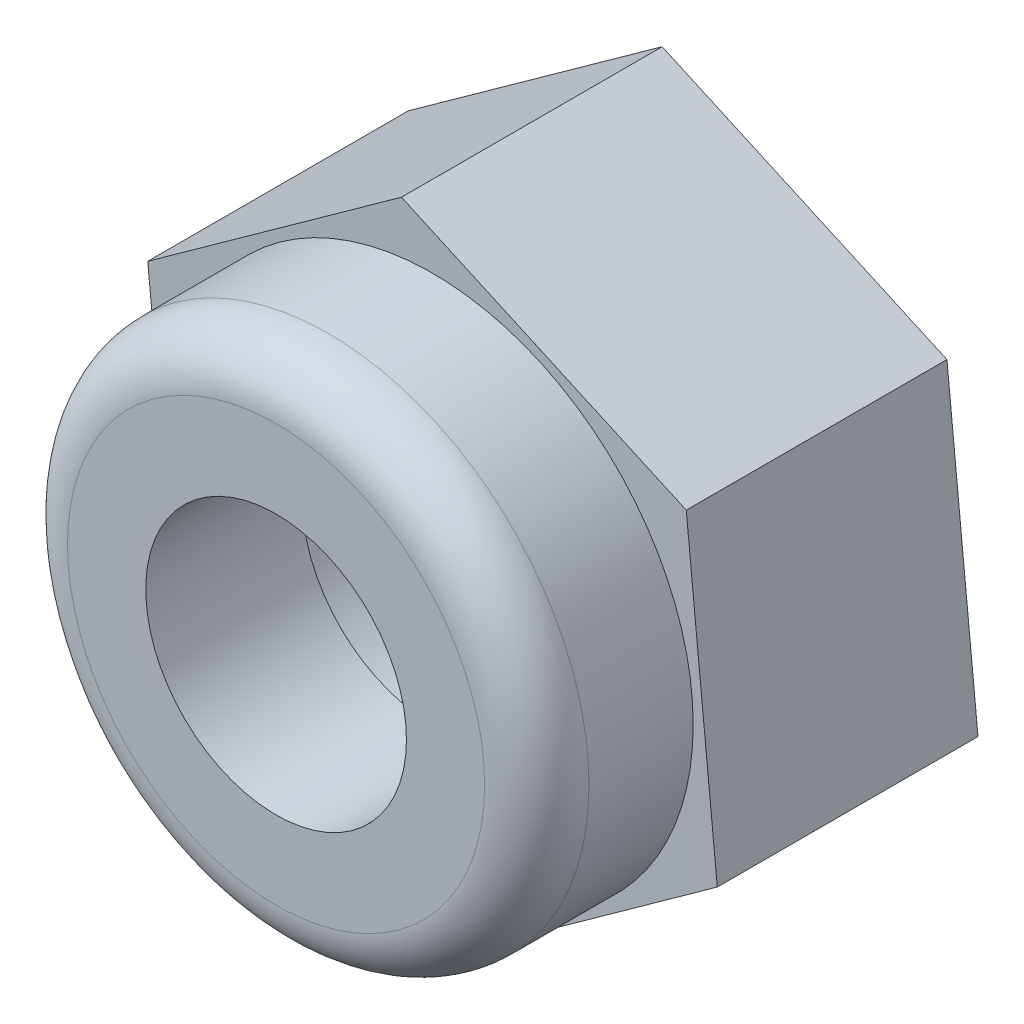
from build123d import *

# Parameters (mm, degrees)
SKETCH_1_R      = 2.5
SKETCH_1_R_2    = 1.25
EXTRUDE_1_DEPTH = 1.5
FILLET_1_R      = 0.5
SKETCH_2_R      = 1.5
EXTRUDE_2_DEPTH = 2.5


with BuildPart() as part:
    # 草图1 → 凸台-拉伸1 (new body)
    with BuildSketch(Plane.XY):
        Circle(SKETCH_1_R)
        Circle(SKETCH_1_R_2, mode=Mode.SUBTRACT)
    extrude(amount=EXTRUDE_1_DEPTH)

    # 圆角1
    fillet_1_edges = [part.edges().sort_by_distance(p)[0] for p in [
        (-2.5, 0, 1.5),
    ]]
    fillet(fillet_1_edges, radius=FILLET_1_R)

    # 草图2 → 凸台-拉伸2 (add)
    with BuildSketch(Plane(origin=(0, 0, 0), x_dir=(-1, 0, 0), z_dir=(0, 0, -1))):
        Polygon((2.433288981, -1.748657981), (2.731026725, 1.232961082), (0.297737744, 2.981619063), (-2.433288981, 1.748657981), (-2.731026725, -1.232961082), (-0.297737744, -2.981619063), align=None)
        Circle(SKETCH_2_R, mode=Mode.SUBTRACT)
    extrude(amount=EXTRUDE_2_DEPTH)


solid = part.part
